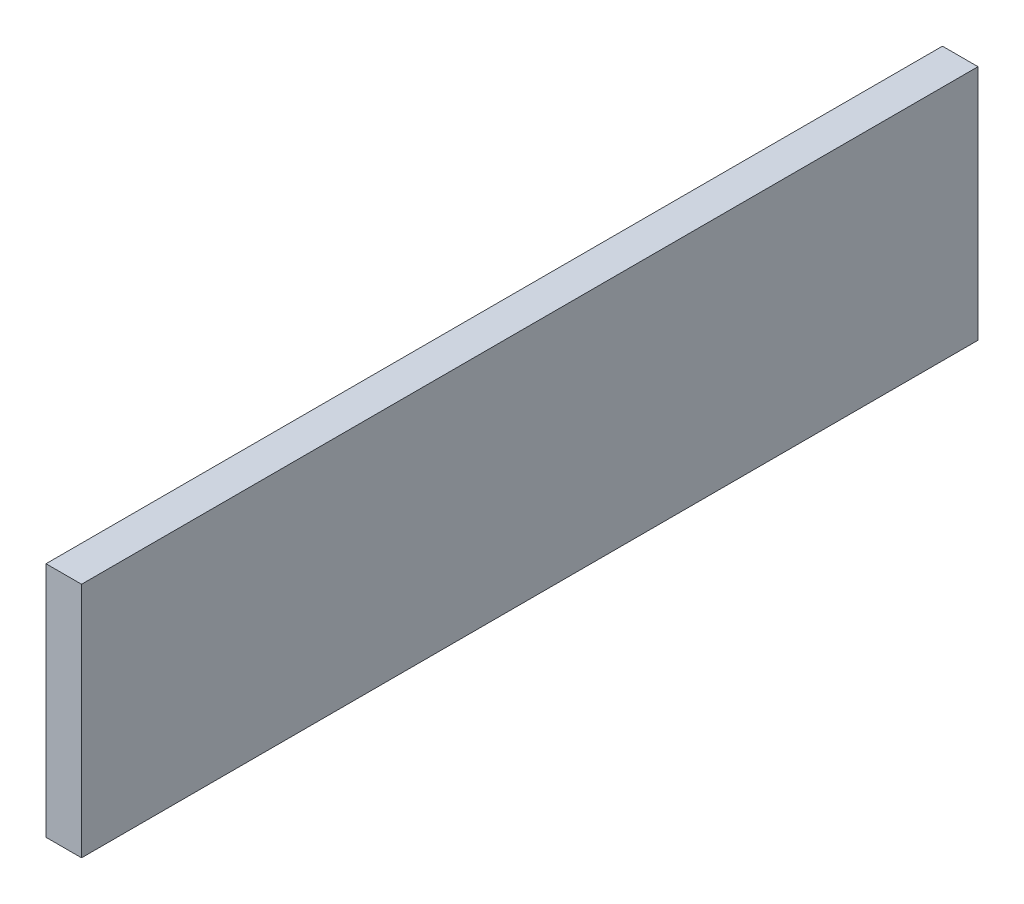
from build123d import *

# Parameters (mm, degrees)
SKETCH1_W           = 454
SKETCH1_H           = 120
BOSS_EXTRUDE1_DEPTH = 18


with BuildPart() as part:
    # Sketch1 → Boss-Extrude1 (new body)
    with BuildSketch(Plane(origin=(0, 0, 0), x_dir=(0, 0, -1), z_dir=(1, 0, 0))):
        with Locations((227, 60)):
            Rectangle(SKETCH1_W, SKETCH1_H)
    extrude(amount=BOSS_EXTRUDE1_DEPTH)


solid = part.part
